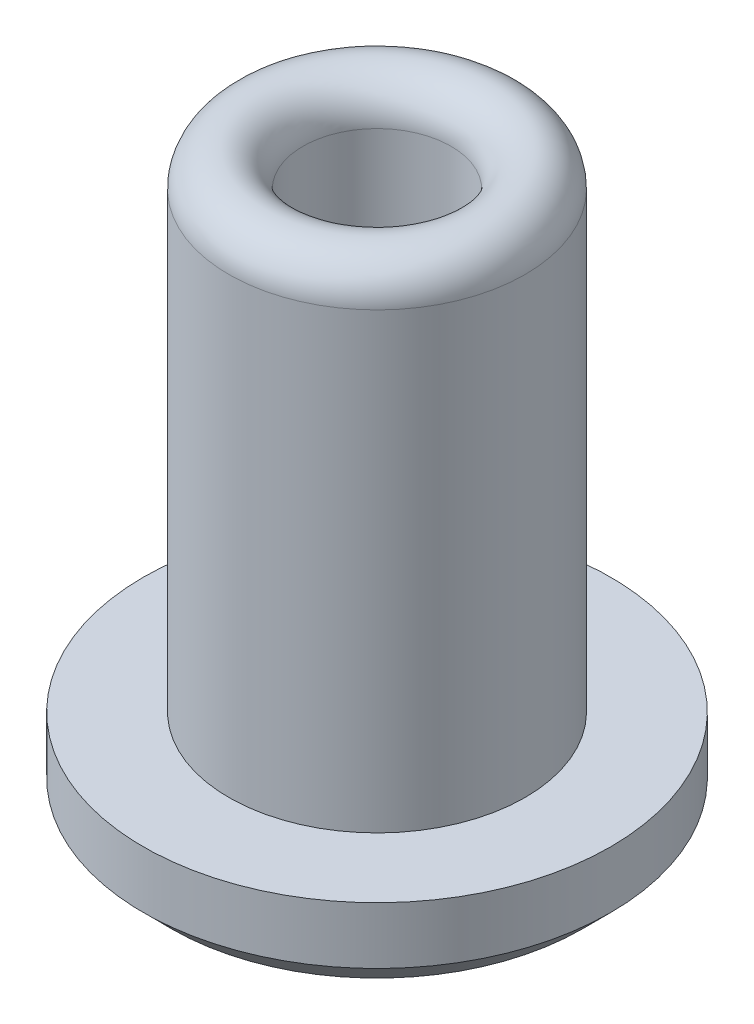
from build123d import *

# Parameters (mm, degrees)
CHAMFER1_SIZE = 0.5


with BuildPart() as part:
    # Sketch1 → Revolve1 (revolve)
    with BuildSketch(Plane.XY, mode=Mode.PRIVATE) as revolve1_sk:
        with BuildLine():
            Line((0, 0), (0, 0.5))
            Line((0, 0.5), (-0.3, 0.5))
            ThreePointArc((-0.3, 0.5), (-1.007106781, 0.792893219), (-1.3, 1.5))
            Line((-1.3, 1.5), (-1.3, 9.45))
            ThreePointArc((-1.3, 9.45), (-1.95, 10.1), (-2.6, 9.45))
            Line((-2.6, 9.45), (-2.6, 1.5))
            Line((-2.6, 1.5), (-4.1, 1.5))
            Line((-4.1, 1.5), (-4.1, 0))
            Line((-4.1, 0), (0, 0))
        make_face()
    revolve(revolve1_sk.sketch.rotate(Axis((0, -1000, 0), (0, 1, 0)), 180), axis=Axis((0, -1000, 0), (0, 1, 0)))

    # Chamfer1
    chamfer1_edges = [part.edges().sort_by_distance(p)[0] for p in [
        (-4.1, 0, 0),
    ]]
    chamfer(chamfer1_edges, length=CHAMFER1_SIZE)


solid = part.part
